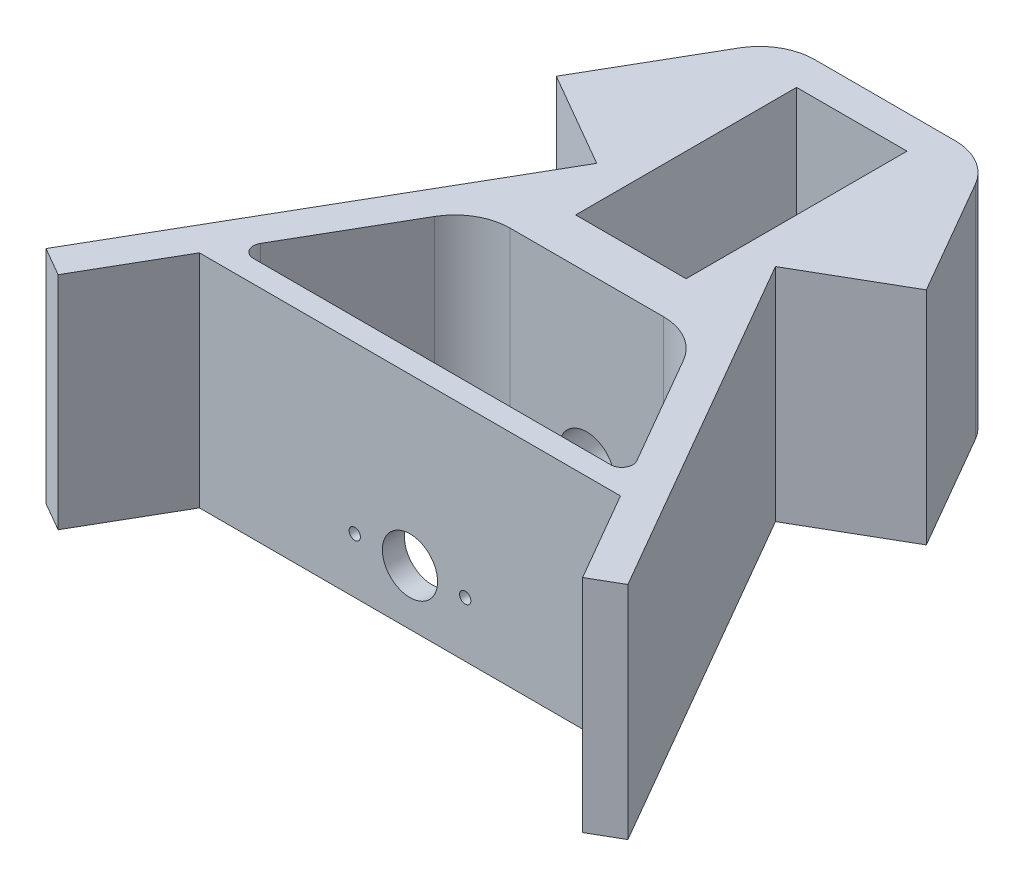
from build123d import *

# Parameters (mm, degrees)
SKETCH_1_W              = 20
SKETCH_1_H              = 40
EXTRUDE_763_DEPTH       = 20
FILLET_1_R              = 10
FILLET_2_R              = 2
CUT_EXTRUDE_1402_REACH  = 104.816
SKETCH_2_R              = 5
HOLE_WIZARD_M2_5_REACH  = 104.816
HOLE_WIZARD_M2_5_BORE_R = 1.025


with BuildPart() as part:
    # Эскиз1 → Extrude 763 (new, symmetric)
    with BuildSketch(Plane(origin=(0, 0, 0), x_dir=(1, 0, 0), z_dir=(0, 1, 0))):
        Polygon((-38.118802154, -50), (38.118802154, -50), (47.483339502, -66.219854476), (52.679491924, -63.219854476), (16.179491924, 0), (33.5, 10), (18.488893001, 36), (-18.488893001, 36), (-33.5, 10), (-16.179491924, 0), (-52.679491924, -63.219854476), (-47.483339502, -66.219854476), align=None)
        Polygon((-35.809401077, -46), (-19.643593539, -18), (19.643593539, -18), (35.809401077, -46), align=None, mode=Mode.SUBTRACT)
        with Locations((0, 10)):
            Rectangle(SKETCH_1_W, SKETCH_1_H, mode=Mode.SUBTRACT)
    extrude(amount=EXTRUDE_763_DEPTH, both=True)

    # Скругление1
    fillet_1_edges = [part.edges().sort_by_distance(p)[0] for p in [
        (-18.488893001, 0, -36),
        (18.488893001, 0, -36),
        (19.643593539, 0, 18),
        (-19.643593539, 0, 18),
    ]]
    fillet(fillet_1_edges, radius=FILLET_1_R)

    # Скругление2
    fillet_2_edges = [part.edges().sort_by_distance(p)[0] for p in [
        (35.809401077, 0, 46),
        (-35.809401077, 0, 46),
    ]]
    fillet(fillet_2_edges, radius=FILLET_2_R)

    # Cut-Extrude 1402: up to this face of the body (flat: up to its plane)
    cut_extrude_1402_end = Plane(part.part.faces().sort_by_distance((0, 0, 10))[0])
    # Эскиз2 → Cut-Extrude 1402 (cut, up to the picked face)
    with BuildSketch(Plane.XY.offset(50), mode=Mode.PRIVATE) as cut_extrude_1402_sk1:
        with Locations((0, -10)):
            Circle(SKETCH_2_R)
    cut_extrude_1402_tool1 = split(extrude(cut_extrude_1402_sk1.sketch, amount=-CUT_EXTRUDE_1402_REACH, mode=Mode.PRIVATE), bisect_by=cut_extrude_1402_end, keep=Keep.BOTH, mode=Mode.PRIVATE)
    add(cut_extrude_1402_tool1.solids().sort_by(Axis((0, -10, 50), (0, 0, -1)))[0], mode=Mode.SUBTRACT)

    # Заглушка подшипника M2.5 bore → Заглушка подшипника M2.5 (cut, up to next)
    with BuildSketch(Plane.XY.offset(50), mode=Mode.PRIVATE) as hole_wizard_m2_5_sk1:
        with Locations((-10, -10)):
            Circle(HOLE_WIZARD_M2_5_BORE_R)
    hole_wizard_m2_5_tool1 = extrude(hole_wizard_m2_5_sk1.sketch, amount=-HOLE_WIZARD_M2_5_REACH, mode=Mode.PRIVATE) & part.part
    # Заглушка подшипника M2.5 bore → Заглушка подшипника M2.5 (cut, up to next)
    with BuildSketch(Plane.XY.offset(50), mode=Mode.PRIVATE) as hole_wizard_m2_5_sk2:
        with Locations((10, -10)):
            Circle(HOLE_WIZARD_M2_5_BORE_R)
    hole_wizard_m2_5_tool2 = extrude(hole_wizard_m2_5_sk2.sketch, amount=-HOLE_WIZARD_M2_5_REACH, mode=Mode.PRIVATE) & part.part
    add(hole_wizard_m2_5_tool1.solids().sort_by_distance((-10, -10, 50))[0], mode=Mode.SUBTRACT)
    add(hole_wizard_m2_5_tool2.solids().sort_by_distance((10, -10, 50))[0], mode=Mode.SUBTRACT)


solid = part.part
